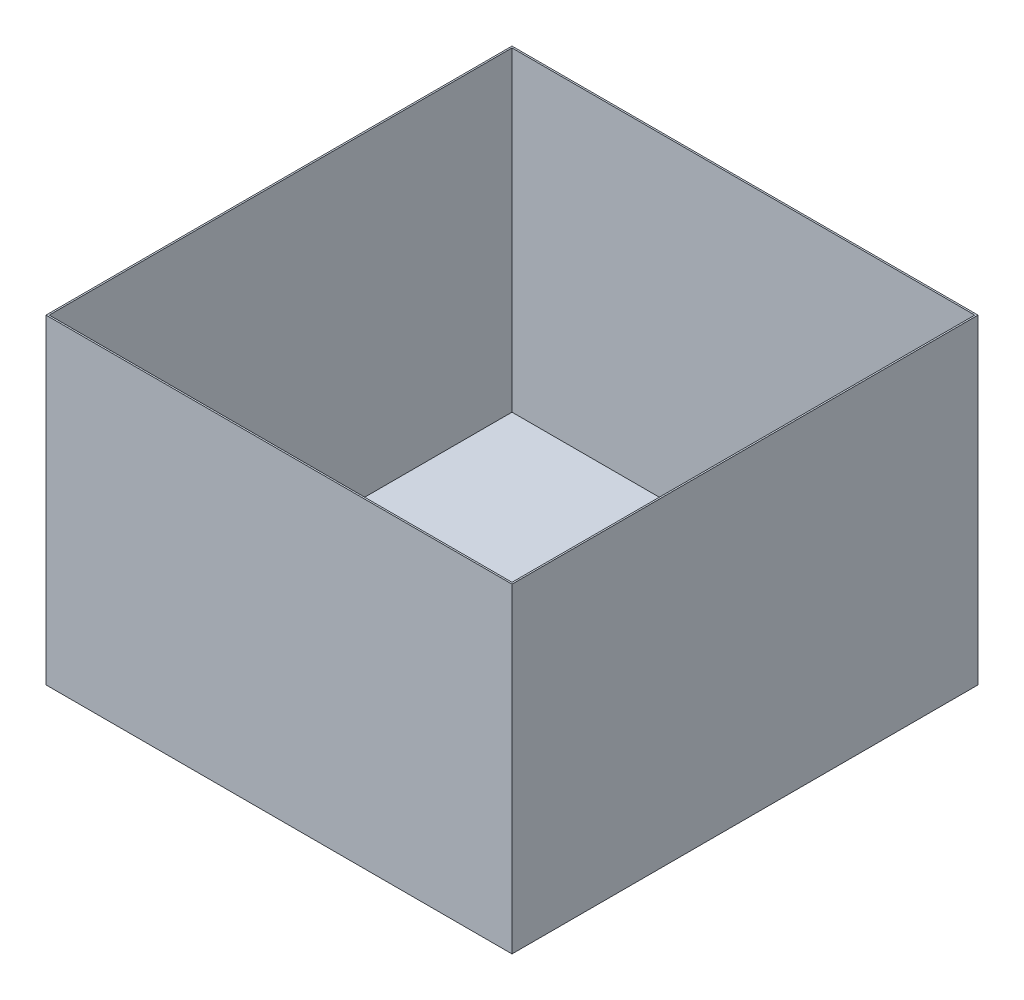
from build123d import *

# Parameters (mm, degrees)
SKETCH1_W           = 923.925
SKETCH1_H           = 923.925
SKETCH1_W_2         = 917.575
SKETCH1_H_2         = 917.575
BOSS_EXTRUDE1_DEPTH = 635
SKETCH1_2_W         = 917.575
SKETCH1_2_H         = 917.575
BOSS_EXTRUDE2_DEPTH = 9.525


with BuildPart() as part:
    # Sketch1 → Boss-Extrude1 (new body)
    with BuildSketch(Plane(origin=(0, 0, 0), x_dir=(1, 0, 0), z_dir=(0, 1, 0))):
        Rectangle(SKETCH1_W, SKETCH1_H)
        Rectangle(SKETCH1_W_2, SKETCH1_H_2, mode=Mode.SUBTRACT)
    extrude(amount=BOSS_EXTRUDE1_DEPTH)

    # Sketch1<2> → Boss-Extrude2 (add)
    with BuildSketch(Plane(origin=(0, 0, 0), x_dir=(1, 0, 0), z_dir=(0, 1, 0))):
        Rectangle(SKETCH1_2_W, SKETCH1_2_H)
    extrude(amount=BOSS_EXTRUDE2_DEPTH)


solid = part.part
